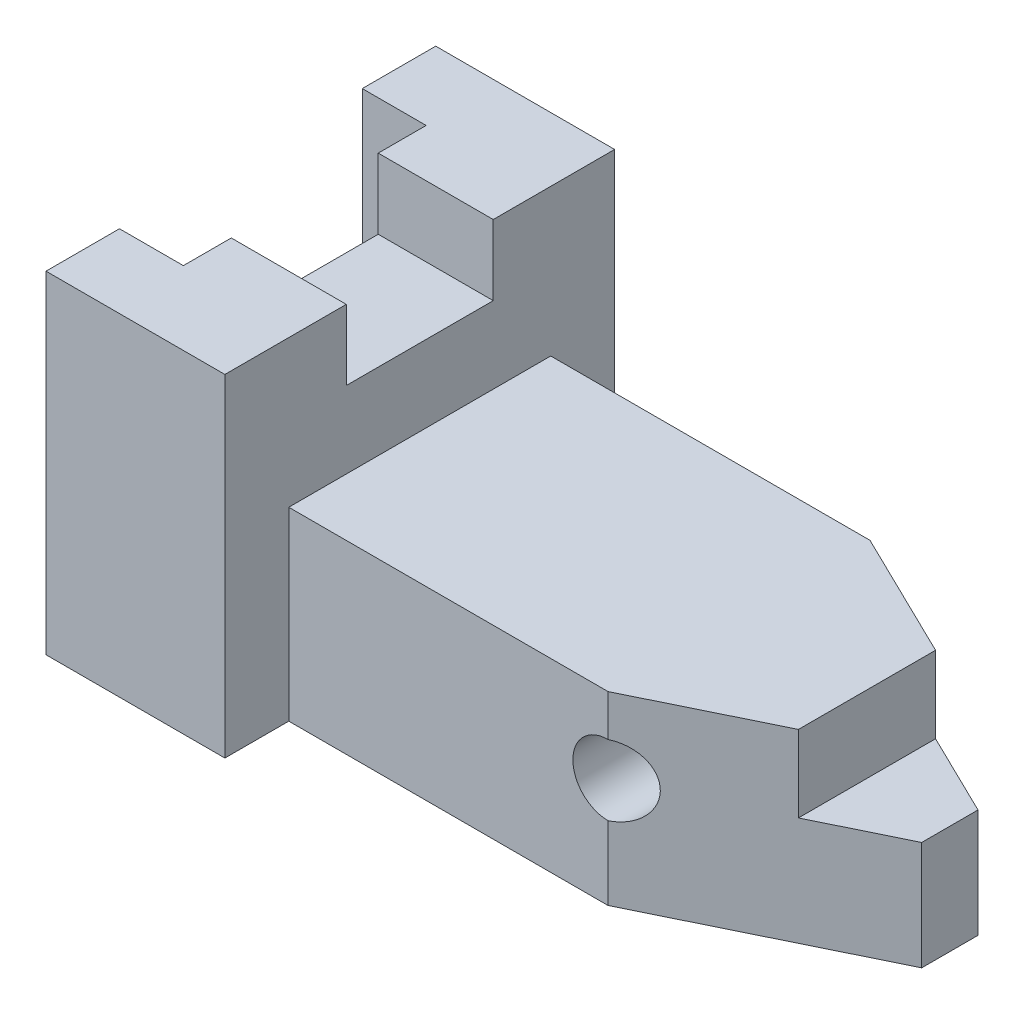
from build123d import *

# Parameters (mm, degrees)
BOSS_EXTRUDE1_DEPTH   = 52
BOSS_EXTRUDE1_2_DEPTH = 52
SKETCH1_3_W           = 18
SKETCH1_3_H           = 23
BOSS_EXTRUDE2_DEPTH   = 41
BOSS_EXTRUDE3_DEPTH   = 29
BOSS_EXTRUDE4_DEPTH   = 17
SKETCH2_R             = 5.5
CUT_EXTRUDE1_DEPTH    = 30.5


with BuildPart() as part:
    # Sketch1 → Boss-Extrude1 (new body)
    with BuildSketch(Plane(origin=(0, 0, 0), x_dir=(1, 0, 0), z_dir=(0, 1, 0))):
        Polygon((0, 19), (10, 19), (10, 11.5), (28, 11.5), (28, 30.5), (0, 30.5), align=None)
    extrude(amount=BOSS_EXTRUDE1_DEPTH)



with BuildPart() as body_2:
    # Sketch1 → Boss-Extrude1 2 (new body)
    with BuildSketch(Plane(origin=(0, 0, 0), x_dir=(1, 0, 0), z_dir=(0, 1, 0))):
        Polygon((28, -11.5), (10, -11.5), (10, -19), (0, -19), (0, -30.5), (28, -30.5), align=None)
    extrude(amount=BOSS_EXTRUDE1_2_DEPTH)


with BuildPart() as part_1:
    add(part.part)

    add(body_2.part)  # Boss-Extrude2 merges body 2
    # Sketch1<3> → Boss-Extrude2 (add)
    with BuildSketch(Plane(origin=(0, 0, 0), x_dir=(1, 0, 0), z_dir=(0, 1, 0))):
        with Locations((19, 0)):
            Rectangle(SKETCH1_3_W, SKETCH1_3_H)
    extrude(amount=BOSS_EXTRUDE2_DEPTH)

    # Sketch1<4> → Boss-Extrude3 (add)
    with BuildSketch(Plane(origin=(0, 0, 0), x_dir=(1, 0, 0), z_dir=(0, 1, 0))):
        Polygon((28, 20.5), (28, 11.5), (28, -11.5), (28, -20.5), (77.968771248, -20.5), (98, -10.730116948), (98, 10.730116948), (77.968771248, 20.5), align=None)
    extrude(amount=BOSS_EXTRUDE3_DEPTH)

    # Sketch1<5> → Boss-Extrude4 (add)
    with BuildSketch(Plane(origin=(0, 0, 0), x_dir=(1, 0, 0), z_dir=(0, 1, 0))):
        Polygon((110.968771248, 4.404824577), (98, 10.730116948), (98, -10.730116948), (110.968771248, -4.404824577), align=None)
    extrude(amount=BOSS_EXTRUDE4_DEPTH)

    # Sketch2 → Cut-Extrude1 (cut, symmetric)
    with BuildSketch(Plane.XY):
        with Locations((77.968771248, 17)):
            Circle(SKETCH2_R)
    extrude(amount=CUT_EXTRUDE1_DEPTH, both=True, mode=Mode.SUBTRACT)


solid = part_1.part
